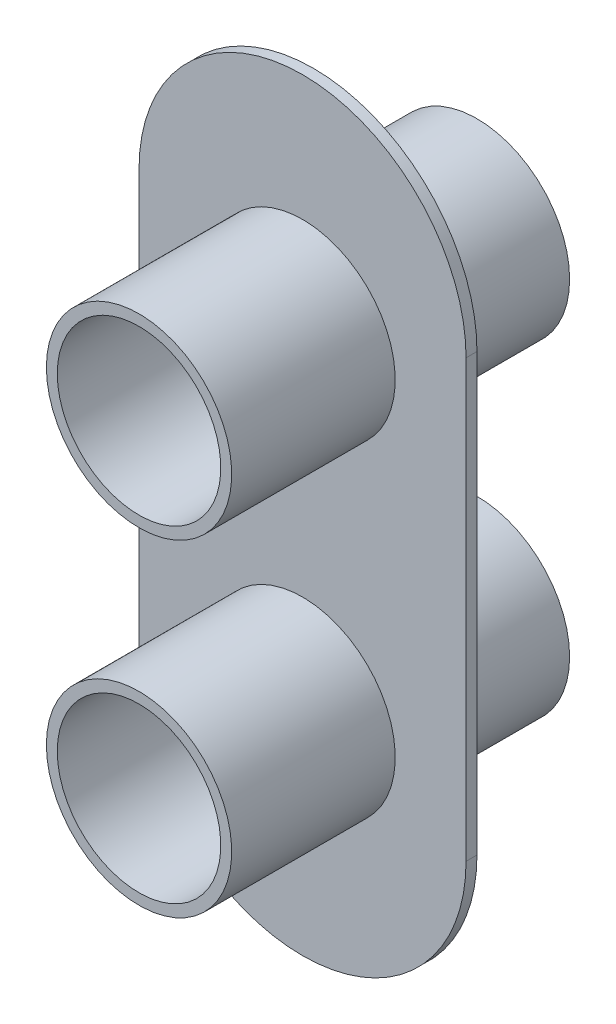
from build123d import *

# Parameters (mm, degrees)
BOSS_EXTRUDE1_DEPTH     = 2.54
SKETCH5_R               = 21.59
BOSS_EXTRUDE5_DEPTH     = 38.1
BOSS_EXTRUDE6_START     = 38.1
SKETCH2_R               = 21.59
BOSS_EXTRUDE6_DEPTH     = 38.1
CUT_EXTRUDE2_DEPTH      = 125.718914363
CUT_EXTRUDE2_DEPTH_BACK = 125.718914363
SKETCH6_R               = 19.05


with BuildPart() as part:
    # Sketch1 → Boss-Extrude1 (new body)
    with BuildSketch(Plane.XY):
        with BuildLine():
            Line((38.1, 50.8), (0, 50.8))
            Line((0, 50.8), (-38.1, 50.8))
            ThreePointArc((-38.1, 50.8), (0, 12.7), (38.1, 50.8))
        make_face()
        with BuildLine():
            Line((-38.1, 50.8), (0, 50.8))
            Line((0, 50.8), (38.1, 50.8))
            ThreePointArc((38.1, 50.8), (0, 88.9), (-38.1, 50.8))
        make_face()
        with BuildLine():
            ThreePointArc((38.1, 50.8), (0, 12.7), (-38.1, 50.8))
            Line((-38.1, 50.8), (-38.1, -50.8))
            ThreePointArc((-38.1, -50.8), (0, -12.7), (38.1, -50.8))
            Line((38.1, -50.8), (38.1, 50.8))
        make_face()
        with BuildLine():
            ThreePointArc((38.1, -50.8), (0, -12.7), (-38.1, -50.8))
            Line((-38.1, -50.8), (0, -50.8))
            Line((0, -50.8), (38.1, -50.8))
        make_face()
        with BuildLine():
            Line((0, -50.8), (-38.1, -50.8))
            ThreePointArc((-38.1, -50.8), (0, -88.9), (38.1, -50.8))
            Line((38.1, -50.8), (0, -50.8))
        make_face()
    extrude(amount=BOSS_EXTRUDE1_DEPTH)

    # Sketch5 → Boss-Extrude5 (add)
    with BuildSketch(Plane(origin=(0, 0, 0), x_dir=(-1, 0, 0), z_dir=(0, 0, -1))):
        with Locations(Location((0, 38.1, 0), (0, 0, 180))):
            Circle(SKETCH5_R)
        with Locations(Location((0, -38.1, 0), (0, 0, 180))):
            Circle(SKETCH5_R)
    extrude(amount=BOSS_EXTRUDE5_DEPTH)

    # Sketch2 → Boss-Extrude6 (add)
    with BuildSketch(Plane.XY.offset(2.54).offset(BOSS_EXTRUDE6_START)):
        with Locations((0, 38.1)):
            Circle(SKETCH2_R)
        with Locations((0, -38.1)):
            Circle(SKETCH2_R)
    extrude(amount=-BOSS_EXTRUDE6_DEPTH)

    # Sketch6 → Cut-Extrude2 (cut, two sides: drawn at the far end of the back side and taken through both)
    with BuildSketch(Plane(origin=(0, 0, -38.1), x_dir=(-1, 0, 0), z_dir=(0, 0, -1)).offset(-CUT_EXTRUDE2_DEPTH_BACK)):
        with Locations((0, 38.1)):
            Circle(SKETCH6_R)
        with Locations((0, -38.1)):
            Circle(SKETCH6_R)
    extrude(amount=CUT_EXTRUDE2_DEPTH + CUT_EXTRUDE2_DEPTH_BACK, mode=Mode.SUBTRACT)


solid = part.part
